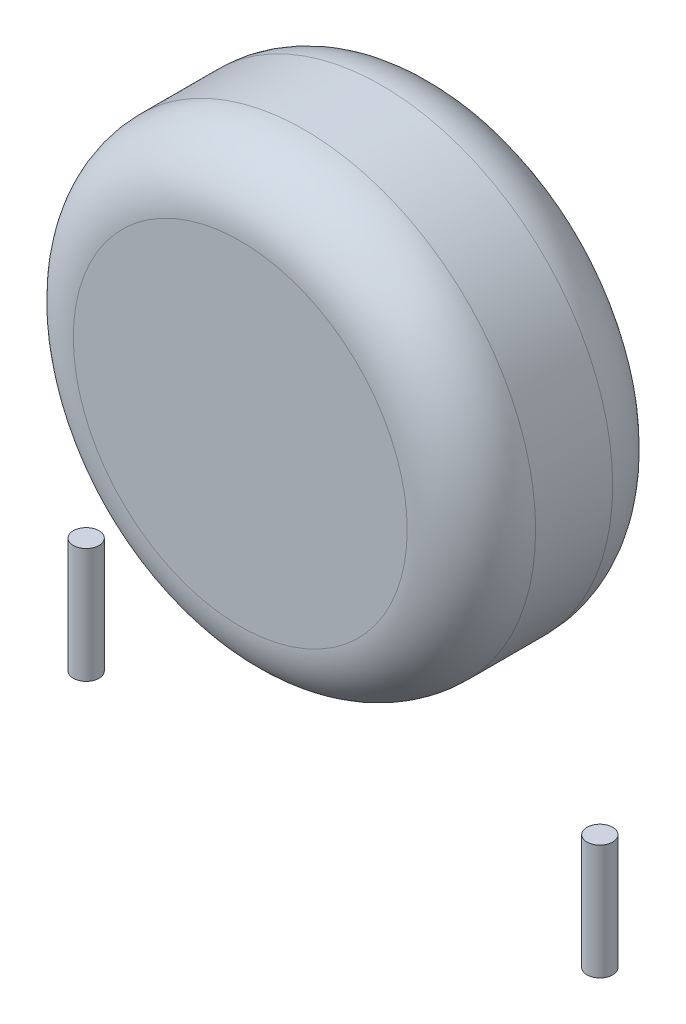
from build123d import *

# Parameters (mm, degrees)
EXTRUDE_1_DEPTH      = 4
EXTRUDE_1_DEPTH_BACK = 4
SKETCH_1_R           = 9
SKETCH_3_R           = 0.5
EXTRUDE_2_DEPTH      = 4.48
EXTRUDE_2_2_DEPTH    = 4.48
FILLET_1_R           = 2.5


with BuildPart() as part:
    # Эскиз1 → Вытянуть1 (new, two sides: drawn at the far end of the back side and taken through both)
    with BuildSketch(Plane.XY.offset(-EXTRUDE_1_DEPTH_BACK)):
        with Locations((0, 15)):
            Circle(SKETCH_1_R)
    extrude(amount=EXTRUDE_1_DEPTH + EXTRUDE_1_DEPTH_BACK)

    # Скругление1
    fillet_1_edges = [part.edges().sort_by_distance(p)[0] for p in [
        (-9, 15, -4),
        (-9, 15, 4),
    ]]
    fillet(fillet_1_edges, radius=FILLET_1_R)


with BuildPart() as body_2:
    # Эскиз3 → Вытянуть2 (new body)
    with BuildSketch(Plane(origin=(0, 0, 0), x_dir=(1, 0, 0), z_dir=(0, 1, 0))):
        with Locations((-10, 0)):
            Circle(SKETCH_3_R)
    extrude(amount=EXTRUDE_2_DEPTH)


with BuildPart() as body_3:
    # Эскиз3 → Extrude 2 2 (new body)
    with BuildSketch(Plane(origin=(0, 0, 0), x_dir=(1, 0, 0), z_dir=(0, 1, 0))):
        with Locations((10, 0)):
            Circle(SKETCH_3_R)
    extrude(amount=EXTRUDE_2_2_DEPTH)


solid = Compound([part.part, body_2.part, body_3.part])
